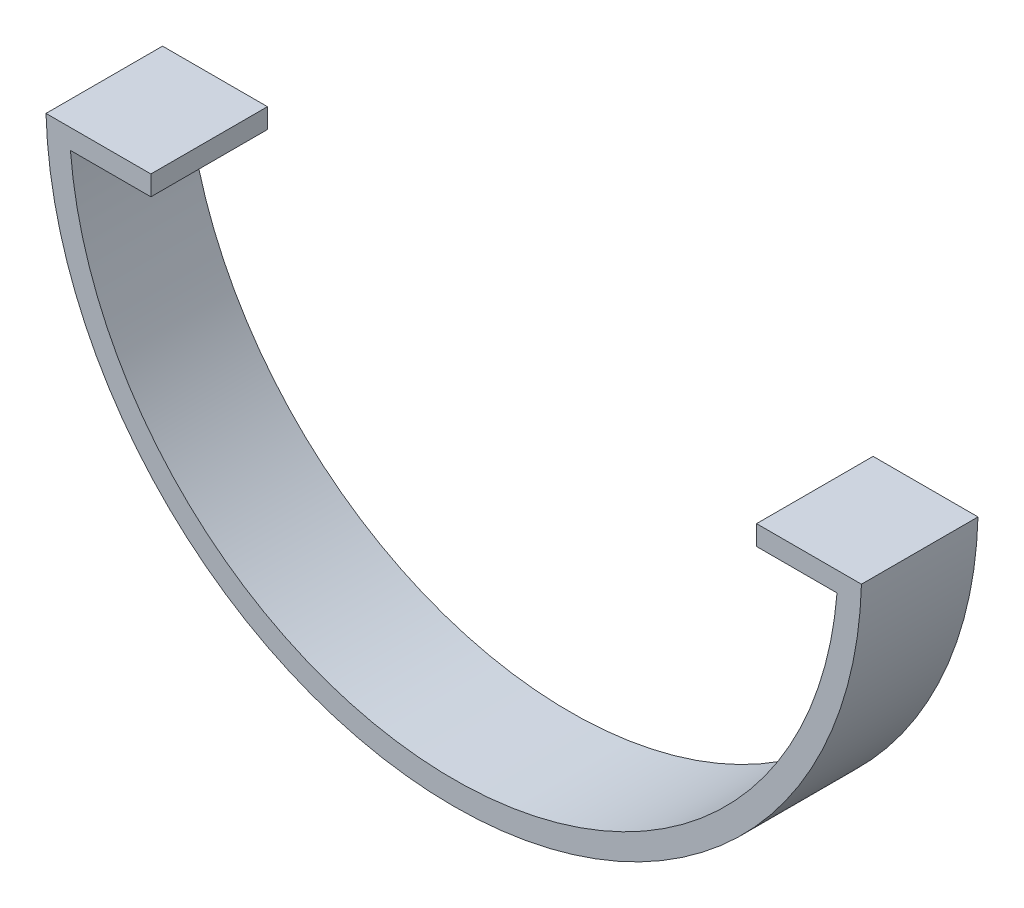
from build123d import *

# Parameters (mm, degrees)
BOSS_EXTRUDE1_DEPTH = 10


with BuildPart() as part:
    # Sketch1 → Boss-Extrude1 (new body)
    with BuildSketch(Plane.XY):
        with BuildLine():
            Line((-34.985711369, -1), (-32.984845005, -1))
            Line((-32.984845005, -1), (-25.984845005, -1))
            Line((-25.984845005, -1), (-25.984845005, -2.7))
            Line((-25.984845005, -2.7), (-32.889359982, -2.7))
            ThreePointArc((-32.889359982, -2.7), (0, -33), (32.889359982, -2.7))
            Line((32.889359982, -2.7), (25.984845005, -2.7))
            Line((25.984845005, -2.7), (25.984845005, -1))
            Line((25.984845005, -1), (32.984845005, -1))
            Line((32.984845005, -1), (34.985711369, -1))
            ThreePointArc((34.985711369, -1), (0, -35), (-34.985711369, -1))
        make_face()
    extrude(amount=BOSS_EXTRUDE1_DEPTH)


solid = part.part
